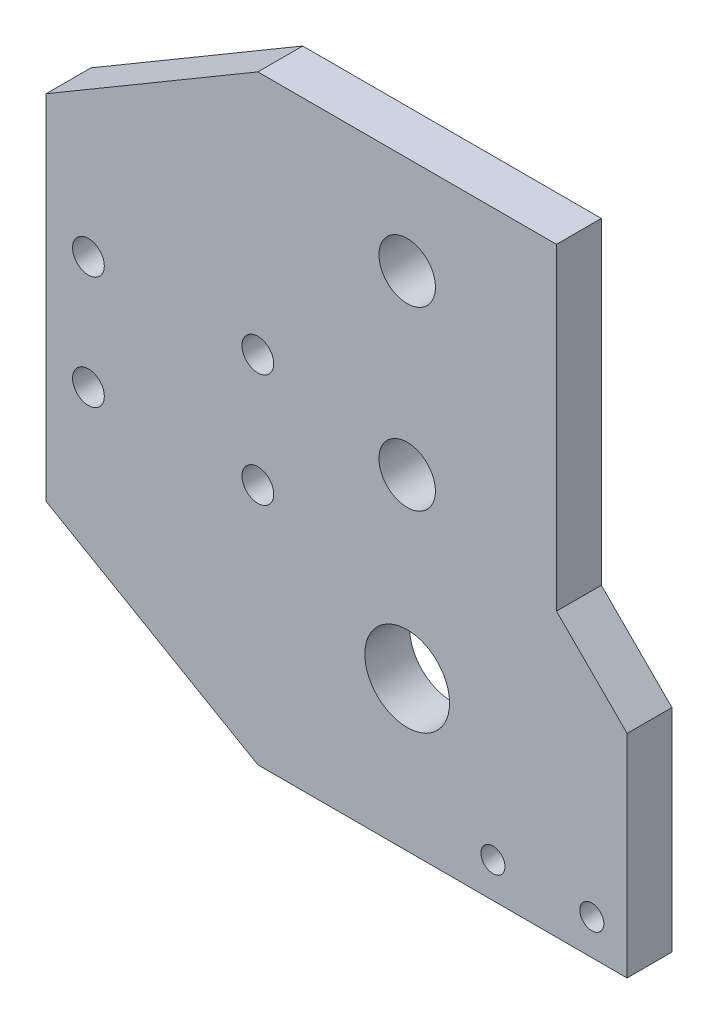
from build123d import *

# Parameters (mm, degrees)
SKETCH2_W            = 42.3
SKETCH2_H            = 85
SKETCH2_R            = 6
SKETCH2_R_2          = 4
BOSS_EXTRUDE1_DEPTH  = 6.35
BOSS_EXTRUDE2_DEPTH  = 6.35
M4_CLEARANCE_HOLE1_D = 4.5
BOSS_EXTRUDE3_DEPTH  = 6.35
M3_CLEARANCE_HOLE2_D = 3.4


with BuildPart() as part:
    # Sketch2 → Boss-Extrude1 (new body)
    with BuildSketch(Plane.XY):
        with Locations((0, 21.35)):
            Rectangle(SKETCH2_W, SKETCH2_H)
        Circle(SKETCH2_R, mode=Mode.SUBTRACT)
        with Locations((0, 25)):
            Circle(SKETCH2_R_2, mode=Mode.SUBTRACT)
        with Locations((0, 50)):
            Circle(SKETCH2_R_2, mode=Mode.SUBTRACT)
    extrude(amount=BOSS_EXTRUDE1_DEPTH)

    # Sketch8 → Boss-Extrude2 (add)
    with BuildSketch(Plane.XY.offset(6.35)):
        Polygon((-21.15, -21.15), (-51.15, -3.829491924), (-51.15, 46.170508076), (-21.15, 63.85), align=None)
    extrude(amount=-BOSS_EXTRUDE2_DEPTH)

    # M4 Clearance Hole1 (through all)
    with Locations(Plane.XY.offset(6.35)):
        with Locations((-21.15, 13.170508076), (-21.15, 29.170508076), (-45.15, 13.170508076), (-45.15, 29.170508076)):
            Hole(M4_CLEARANCE_HOLE1_D / 2)

    # Sketch11 → Boss-Extrude3 (add)
    with BuildSketch(Plane.XY.offset(6.35)):
        Polygon((21.15, -21.15), (31.15, -21.15), (31.15, 8.85), (21.15, 18.85), align=None)
    extrude(amount=-BOSS_EXTRUDE3_DEPTH)

    # M3 Clearance Hole2 (through all)
    with Locations(Plane.XY.offset(6.35)):
        with Locations((12.15, -16.15), (26.15, -16.15)):
            Hole(M3_CLEARANCE_HOLE2_D / 2)


solid = part.part
